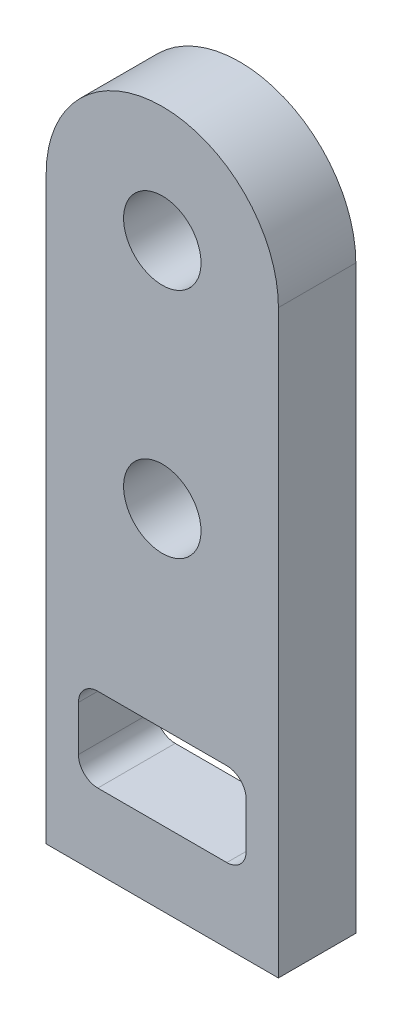
from build123d import *

# Parameters (mm, degrees)
MODEL_R                 = 1.5
SALIENTE_EXTRUIR1_DEPTH = 3


with BuildPart() as part:
    # Model → Saliente-Extruir1 (new body)
    with BuildSketch(Plane.XY):
        with BuildLine():
            Line((159.591356547, 221.494036843), (159.591356547, 198.994036843))
            Line((159.591356547, 198.994036843), (150.591356547, 198.994036843))
            Line((150.591356547, 198.994036843), (150.591356547, 221.494036843))
            ThreePointArc((150.591356547, 221.494036843), (155.091356547, 225.994036843), (159.591356547, 221.494036843))
        make_face()
        with Locations((155.091356547, 221.494036843)):
            Circle(MODEL_R, mode=Mode.SUBTRACT)
        with Locations((155.091356547, 212.494036843)):
            Circle(MODEL_R, mode=Mode.SUBTRACT)
        with BuildLine():
            Line((157.591356547, 201.869036843), (152.591356547, 201.869036843))
            ThreePointArc((152.591356547, 201.869036843), (152.061026462, 202.088706757), (151.841356547, 202.619036843))
            Line((151.841356547, 202.619036843), (151.841356547, 204.369036843))
            ThreePointArc((151.841356547, 204.369036843), (152.061026462, 204.899366929), (152.591356547, 205.119036843))
            Line((152.591356547, 205.119036843), (157.591356547, 205.119036843))
            ThreePointArc((157.591356547, 205.119036843), (158.121686633, 204.899366929), (158.341356547, 204.369036843))
            Line((158.341356547, 204.369036843), (158.341356547, 202.619036843))
            ThreePointArc((158.341356547, 202.619036843), (158.121686633, 202.088706757), (157.591356547, 201.869036843))
        make_face(mode=Mode.SUBTRACT)
    extrude(amount=SALIENTE_EXTRUIR1_DEPTH)


solid = part.part
